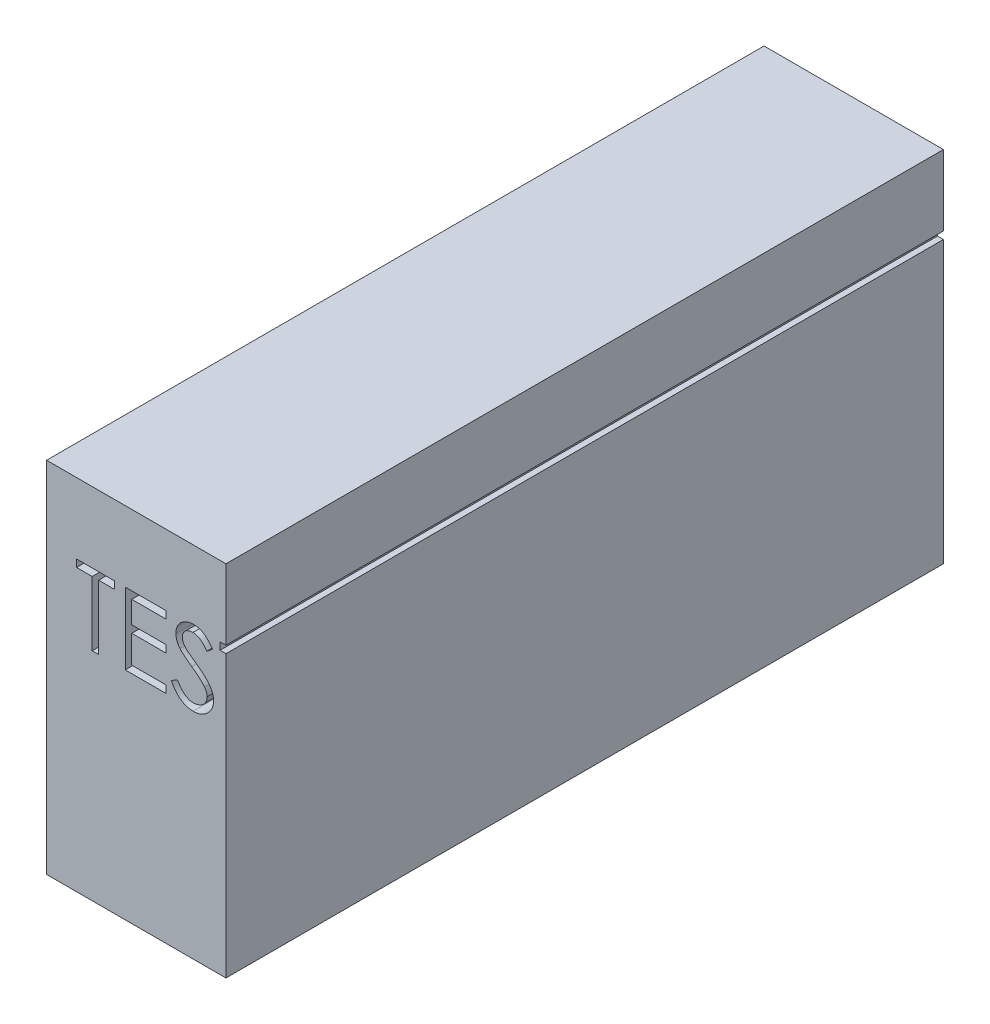
from build123d import *

# Parameters (mm, degrees)
SKETCH1_W      = 50
SKETCH1_H      = 100
EXTRUDE1_DEPTH = 200
EXTRUDE2_DEPTH = 300


with BuildPart() as part:
    # Sketch1 → Extrude1 (new body)
    with BuildSketch(Plane.XY):
        Rectangle(SKETCH1_W, SKETCH1_H)
    extrude(amount=EXTRUDE1_DEPTH)

    # Sketch2 → Extrude2 (cut)
    with BuildSketch(Plane.XY.offset(200)):
        Polygon((-16.64575274, 28.291553165), (-16.64575274, 30.342835216), (-6.132932227, 30.342835216), (-6.132932227, 28.291553165), (-10.491906586, 28.291553165), (-10.491906586, 10.342835216), (-12.286778381, 10.342835216), (-12.286778381, 28.291553165), align=None)
        Polygon((-3.05600915, 30.342835216), (8.226042132, 30.342835216), (8.226042132, 28.291553165), (-1.261137355, 28.291553165), (-1.261137355, 22.137707011), (8.226042132, 22.137707011), (8.226042132, 20.086424959), (-1.261137355, 20.086424959), (-1.261137355, 12.394117267), (8.226042132, 12.394117267), (8.226042132, 10.342835216), (-3.05600915, 10.342835216), align=None)
        with BuildLine():
            Line((9.764503671, 14.201008293), (11.455208799, 15.214630088))
            add(Edge.make_bspline(
                [(11.455208799, 15.214630088), (11.612455869, 14.951405031), (11.913735187, 14.44707598), (12.416314382, 13.765601463), (12.937073874, 13.186389139), (13.479870066, 12.712808524), (14.041389769, 12.339957743), (14.625298648, 12.07594499), (15.229628995, 11.911282274), (15.640907975, 11.891281779), (15.84623444, 11.881296754)],
                knots=[0, 0, 0, 0, 1.272034388, 2.437168799, 3.508375237, 4.49857839, 5.41946034, 6.295179144, 7.148887113, 8, 8, 8, 8], degree=3))
            add(Edge.make_bspline(
                [(15.84623444, 11.881296754), (16.021587928, 11.886180597), (16.369226632, 11.895862827), (16.881010877, 11.988895982), (17.378049747, 12.131822433), (17.850099106, 12.33651347), (18.290645474, 12.58416196), (18.676969448, 12.883282974), (19.010947237, 13.218175578), (19.284142178, 13.591790748), (19.493742379, 13.993603025), (19.654839913, 14.406037033), (19.744240334, 14.835571709), (19.757707497, 15.124774354), (19.764503671, 15.270719831)],
                knots=[0, 0, 0, 0, 1.095163259, 2.171163733, 3.241058638, 4.321873601, 5.38011039, 6.391990106, 7.366004449, 8.327778327, 9.272591725, 10.192022065, 11.087607919, 12, 12, 12, 12], degree=3))
            add(Edge.make_bspline(
                [(19.764503671, 15.270719831), (19.756079038, 15.437238972), (19.738952991, 15.775748053), (19.594201676, 16.275174642), (19.366491694, 16.769417899), (19.156419445, 17.075139416), (19.047356235, 17.233860857)],
                knots=[0, 0, 0, 0, 0.938893495, 1.908633276, 2.914225137, 4, 4, 4, 4], degree=3))
            add(Edge.make_bspline(
                [(19.047356235, 17.233860857), (18.957809868, 17.348414135), (18.769818472, 17.588904412), (18.446632686, 17.946877186), (18.067397747, 18.316125295), (17.645091719, 18.710748477), (17.164331211, 19.11239303), (16.640173986, 19.540211761), (16.059237649, 19.977935058), (15.651811954, 20.271492576), (15.441587004, 20.422963421)],
                knots=[0, 0, 0, 0, 0.722233717, 1.516239348, 2.393582979, 3.351407094, 4.387010283, 5.505090956, 6.712668013, 8, 8, 8, 8], degree=3))
            add(Edge.make_bspline(
                [(15.441587004, 20.422963421), (15.231164169, 20.572841065), (14.828851731, 20.859395706), (14.26623126, 21.284677329), (13.763120043, 21.673499441), (13.321754235, 22.029522367), (12.942327967, 22.352794394), (12.621851332, 22.640211189), (12.368488149, 22.899545822), (12.227599117, 23.067782061), (12.164343414, 23.143315985)],
                knots=[0, 0, 0, 0, 1.452282411, 2.77665338, 3.964542531, 5.026858415, 5.96415736, 6.766646006, 7.446254459, 8, 8, 8, 8], degree=3))
            add(Edge.make_bspline(
                [(12.164343414, 23.143315985), (12.07592887, 23.261036196), (11.902049803, 23.492548789), (11.672529772, 23.854405119), (11.477448841, 24.224823778), (11.324521229, 24.604800147), (11.195742836, 24.988999741), (11.109126089, 25.38243543), (11.054889535, 25.783341822), (11.049335326, 26.053133254), (11.046554953, 26.18818778)],
                knots=[0, 0, 0, 0, 1.068054152, 2.10047183, 3.106115577, 4.101338837, 5.06977816, 6.043150881, 7.020423561, 8, 8, 8, 8], degree=3))
            add(Edge.make_bspline(
                [(11.046554953, 26.18818778), (11.05401329, 26.399786492), (11.068770547, 26.818461142), (11.193573503, 27.430065887), (11.390561467, 28.013988271), (11.666532255, 28.564447321), (12.022288557, 29.067110069), (12.433979839, 29.527758566), (12.924331189, 29.915007607), (13.462346179, 30.253362227), (14.051239734, 30.518196085), (14.66833061, 30.717973114), (15.314599593, 30.831168873), (15.752331791, 30.847413244), (15.974439568, 30.855655729)],
                knots=[0, 0, 0, 0, 1.005424448, 1.989358655, 2.955360095, 3.929531133, 4.905563448, 5.876582895, 6.856512386, 7.866279853, 8.892233794, 9.918561126, 10.94386622, 12, 12, 12, 12], degree=3))
            add(Edge.make_bspline(
                [(15.974439568, 30.855655729), (16.210120141, 30.847526862), (16.67881358, 30.831361142), (17.368237669, 30.69080382), (18.032013191, 30.458228553), (18.565974704, 30.194293364), (18.983876198, 29.930685274), (19.302577528, 29.690571993), (19.62553439, 29.414142801), (19.955351846, 29.100661395), (20.286441328, 28.747251388), (20.623718198, 28.356333166), (20.967971163, 27.930295704), (21.189433221, 27.6261557), (21.302965209, 27.470239062)],
                knots=[0, 0, 0, 0, 1.286793592, 2.559021753, 3.825965368, 5.121522368, 5.803751409, 6.523245864, 7.299691795, 8.125521123, 9.008227632, 9.944561021, 10.946284179, 12, 12, 12, 12], degree=3))
            Line((21.302965209, 27.470239062), (19.680369055, 26.240271113))
            add(Edge.make_bspline(
                [(19.680369055, 26.240271113), (19.582392298, 26.366492201), (19.393711972, 26.609564506), (19.107257761, 26.949972023), (18.837265488, 27.260923335), (18.571263203, 27.531009781), (18.323299595, 27.775021971), (18.082630782, 27.983934867), (17.852720203, 28.159795413), (17.562909285, 28.347472898), (17.198808038, 28.533510061), (16.741753545, 28.690933365), (16.264117688, 28.785533719), (15.938805508, 28.798041647), (15.774119055, 28.804373677)],
                knots=[0, 0, 0, 0, 1.181633172, 2.275549214, 3.290209073, 4.226197932, 5.078386478, 5.862611352, 6.581680152, 7.217281963, 8.414376989, 9.595101626, 10.782541182, 12, 12, 12, 12], degree=3))
            add(Edge.make_bspline(
                [(15.774119055, 28.804373677), (15.567510356, 28.797449678), (15.169084942, 28.784097396), (14.60342645, 28.638268909), (14.094318307, 28.408658279), (13.656875078, 28.086858404), (13.29266378, 27.705595589), (13.029204016, 27.266859274), (12.870631647, 26.782388402), (12.851281478, 26.44443608), (12.841426747, 26.272322395)],
                knots=[0, 0, 0, 0, 1.14458467, 2.207223713, 3.21896685, 4.227309161, 5.202851033, 6.127160689, 7.046193047, 8, 8, 8, 8], degree=3))
            add(Edge.make_bspline(
                [(12.841426747, 26.272322395), (12.843673185, 26.165171089), (12.848169735, 25.950693264), (12.910882864, 25.633827996), (12.991450458, 25.317763199), (13.11912264, 25.003919869), (13.295381518, 24.686809245), (13.526839666, 24.360970745), (13.818344306, 24.02353241), (14.041641519, 23.804061703), (14.159535722, 23.68818778)],
                knots=[0, 0, 0, 0, 0.858281714, 1.717966888, 2.583508476, 3.4729293, 4.427298488, 5.488583878, 6.674047936, 8, 8, 8, 8], degree=3))
            add(Edge.make_bspline(
                [(14.159535722, 23.68818778), (14.203314993, 23.649119061), (14.307324519, 23.556300728), (14.497472666, 23.404344838), (14.74857437, 23.216900425), (15.054072663, 22.984972902), (15.419600444, 22.715935976), (15.845197908, 22.413229621), (16.326120953, 22.067026998), (16.667389044, 21.824983909), (16.847837004, 21.697001883)],
                knots=[0, 0, 0, 0, 0.420754252, 0.999615792, 1.744751191, 2.668019286, 3.750313428, 4.999500688, 6.413464383, 8, 8, 8, 8], degree=3))
            add(Edge.make_bspline(
                [(16.847837004, 21.697001883), (17.064899366, 21.539051257), (17.485210545, 21.233201761), (18.083253859, 20.773683589), (18.625504191, 20.324267769), (19.113865354, 19.8878243), (19.553161974, 19.467663768), (19.938520377, 19.058731309), (20.273867122, 18.663956608), (20.634891228, 18.157827604), (21.003793054, 17.536221408), (21.320601667, 16.774631474), (21.520363653, 16.010081071), (21.546486598, 15.496213434), (21.559375465, 15.242674959)],
                knots=[0, 0, 0, 0, 1.163667725, 2.253281268, 3.268753668, 4.215851969, 5.092017293, 5.902905408, 6.650798638, 7.335211899, 8.59617414, 9.77448103, 10.901945474, 12, 12, 12, 12], degree=3))
            add(Edge.make_bspline(
                [(21.559375465, 15.242674959), (21.55562039, 15.063370016), (21.548183161, 14.70824211), (21.462692226, 14.186784528), (21.337436996, 13.680322415), (21.148652802, 13.195116059), (20.918234755, 12.722288843), (20.625856196, 12.274243698), (20.28695514, 11.841064278), (19.898190769, 11.43430147), (19.472785613, 11.060894636), (19.023164501, 10.72872857), (18.548591512, 10.451766722), (18.051641131, 10.22576191), (17.532199207, 10.048998953), (16.990440443, 9.920925415), (16.425471807, 9.842321353), (16.041469055, 9.834162716), (15.84623444, 9.830014703)],
                knots=[0, 0, 0, 0, 0.983748083, 1.948392443, 2.894712957, 3.844097841, 4.80183111, 5.778335162, 6.776009319, 7.81870978, 8.863265674, 9.881300176, 10.883814829, 11.87499822, 12.874611388, 13.892143829, 14.928324115, 16, 16, 16, 16], degree=3))
            add(Edge.make_bspline(
                [(15.84623444, 9.830014703), (15.695175337, 9.832935741), (15.394959565, 9.838741029), (14.950905383, 9.890062631), (14.515822016, 9.962674652), (14.095168976, 10.077955051), (13.683526624, 10.217823492), (13.282685284, 10.390042535), (12.89245069, 10.596426543), (12.510635931, 10.832398113), (12.138212076, 11.107013796), (11.778672259, 11.426862347), (11.420219771, 11.783122376), (11.073434649, 12.185468452), (10.731302396, 12.627400354), (10.400568627, 13.11305283), (10.074387383, 13.639780566), (9.869727567, 14.010438199), (9.764503671, 14.201008293)],
                knots=[0, 0, 0, 0, 0.915332311, 1.819136955, 2.706846663, 3.586547465, 4.459518054, 5.340707479, 6.227863349, 7.133153174, 8.059268498, 9.028702269, 10.047606654, 11.120612155, 12.245963614, 13.433783089, 14.680604001, 16, 16, 16, 16], degree=3))
        make_face()
        Polygon((23.35424726, 28.291553165), (23.35424726, 30.342835216), (33.867067773, 30.342835216), (33.867067773, 28.291553165), (29.508093414, 28.291553165), (29.508093414, 10.342835216), (27.713221619, 10.342835216), (27.713221619, 28.291553165), align=None)
    extrude(amount=-EXTRUDE2_DEPTH, mode=Mode.SUBTRACT)


solid = part.part
